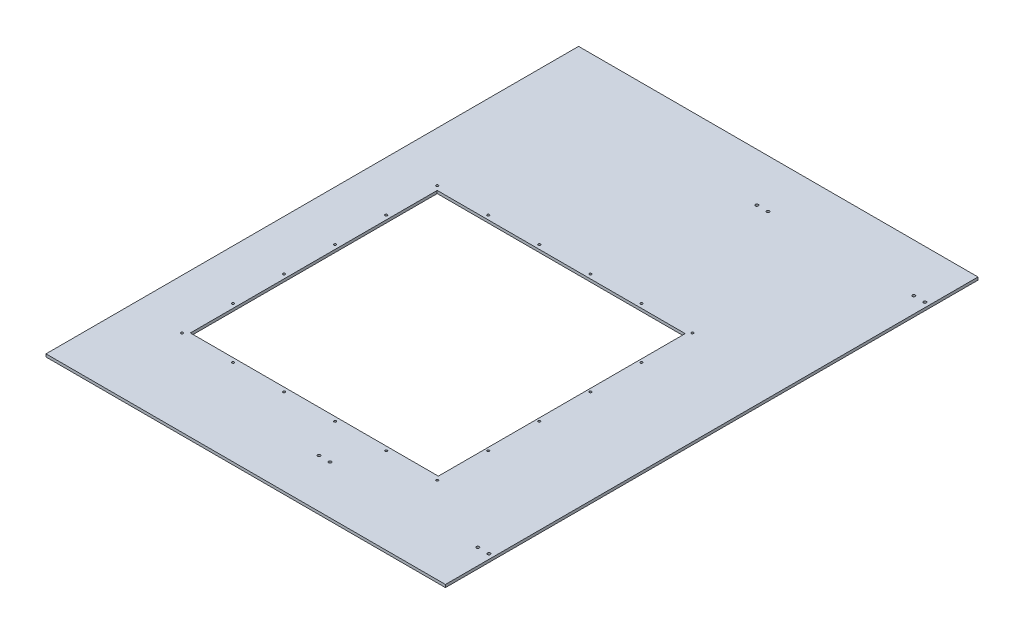
from build123d import *

# Parameters (mm, degrees)
SKETCH1_W           = 914.4
SKETCH1_H           = 1219.2
BOSS_EXTRUDE1_DEPTH = 6.35
SKETCH2_R           = 3.2639
CUT_EXTRUDE1_DEPTH  = 763.026457874
SKETCH3_W           = 567.7408
SKETCH3_H           = 565.15
SKETCH3_R           = 2.5908
CUT_EXTRUDE2_DEPTH  = 763.026457874


with BuildPart() as part:
    # Sketch1 → Boss-Extrude1 (new body)
    with BuildSketch(Plane(origin=(0, 0, 0), x_dir=(1, 0, 0), z_dir=(0, 1, 0))):
        Rectangle(SKETCH1_W, SKETCH1_H)
    extrude(amount=BOSS_EXTRUDE1_DEPTH)

    # Sketch2 → Cut-Extrude1 (cut, through all)
    with BuildSketch(Plane.XZ):
        with Locations((56.9595, 498.8814)):
            Circle(SKETCH2_R)
        with Locations((82.3595, 498.8814)):
            Circle(SKETCH2_R)
        with Locations((446.0875, 498.8814)):
            Circle(SKETCH2_R)
        with Locations((420.6875, 498.8814)):
            Circle(SKETCH2_R)
        with Locations((61.722, -498.8814)):
            Circle(SKETCH2_R)
        with Locations((87.122, -498.8814)):
            Circle(SKETCH2_R)
        with Locations((420.878, -498.8814)):
            Circle(SKETCH2_R)
        with Locations((446.278, -498.8814)):
            Circle(SKETCH2_R)
    extrude(amount=-CUT_EXTRUDE1_DEPTH, mode=Mode.SUBTRACT)

    # Sketch3 → Cut-Extrude2 (cut, through all)
    with BuildSketch(Plane(origin=(0, 6.35, 0), x_dir=(1, 0, 0), z_dir=(0, 1, 0))):
        with Locations((-49.5046, -120.396)):
            Rectangle(SKETCH3_W, SKETCH3_H)
        with Locations((241.3, 171.704)):
            Circle(SKETCH3_R)
        with Locations((241.3, 54.864)):
            Circle(SKETCH3_R)
        with Locations((241.3, -61.976)):
            Circle(SKETCH3_R)
        with Locations((241.3, -178.816)):
            Circle(SKETCH3_R)
        with Locations((241.3, -295.656)):
            Circle(SKETCH3_R)
        with Locations((241.3, -412.496)):
            Circle(SKETCH3_R)
        with Locations((-342.9, -412.496)):
            Circle(SKETCH3_R)
        with Locations((-226.06, -412.496)):
            Circle(SKETCH3_R)
        with Locations((-109.22, -412.496)):
            Circle(SKETCH3_R)
        with Locations((7.62, -412.496)):
            Circle(SKETCH3_R)
        with Locations((124.46, -412.496)):
            Circle(SKETCH3_R)
        with Locations((-342.9, -295.656)):
            Circle(SKETCH3_R)
        with Locations((-342.9, -178.816)):
            Circle(SKETCH3_R)
        with Locations((-342.9, -61.976)):
            Circle(SKETCH3_R)
        with Locations((-342.9, 54.864)):
            Circle(SKETCH3_R)
        with Locations((124.46, 171.704)):
            Circle(SKETCH3_R)
        with Locations((7.62, 171.704)):
            Circle(SKETCH3_R)
        with Locations((-109.22, 171.704)):
            Circle(SKETCH3_R)
        with Locations((-226.06, 171.704)):
            Circle(SKETCH3_R)
        with Locations((-342.9, 171.704)):
            Circle(SKETCH3_R)
    extrude(amount=-CUT_EXTRUDE2_DEPTH, mode=Mode.SUBTRACT)


solid = part.part
